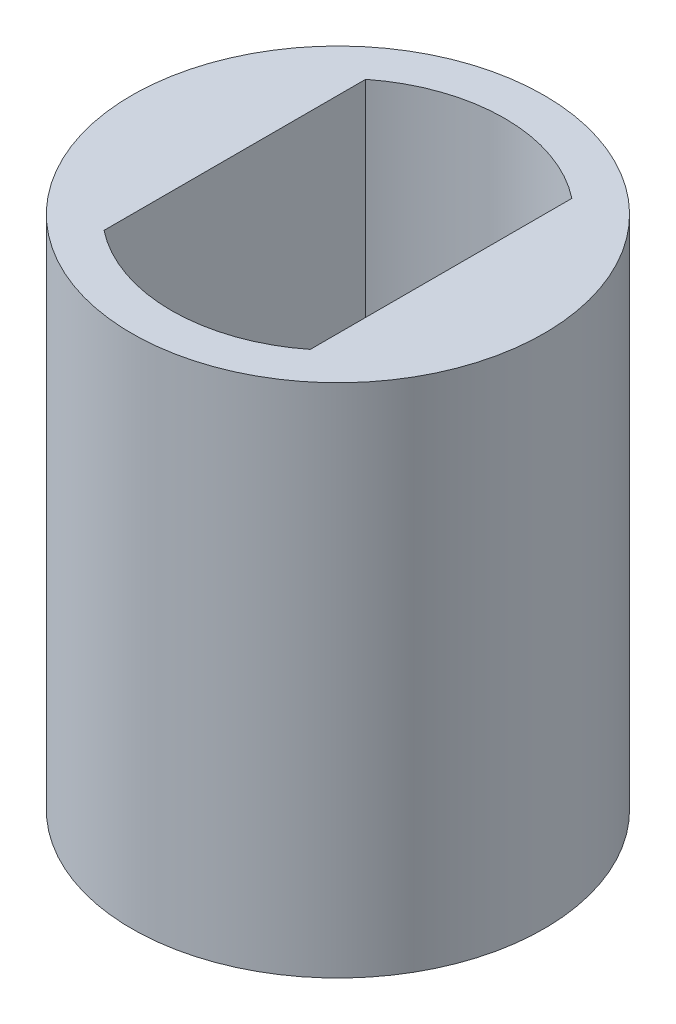
from build123d import *

# Parameters (mm, degrees)
RESSALTO_EXTRUS_O2_DEPTH = 6.5


with BuildPart() as part:
    # Esboço1 → Ressalto-extrusão2 (new body)
    with BuildSketch(Plane(origin=(0, 0, 0), x_dir=(1, 0, 0), z_dir=(0, 1, 0))):
        with BuildLine():
            Line((-1.3, -1.64924225), (-1.3, 1.64924225))
            ThreePointArc((-1.3, 1.64924225), (-2.1, 0), (-1.3, -1.64924225))
        make_face()
        with BuildLine():
            Line((-1.3, 1.64924225), (-1.3, 2.25166605))
            ThreePointArc((-1.3, 2.25166605), (-2.6, 0), (-1.3, -2.25166605))
            Line((-1.3, -2.25166605), (-1.3, -1.64924225))
            ThreePointArc((-1.3, -1.64924225), (-2.1, 0), (-1.3, 1.64924225))
        make_face()
        with BuildLine():
            Line((0, 2.1), (0, 2.6))
            ThreePointArc((0, 2.6), (-0.672929517, 2.511407148), (-1.3, 2.25166605))
            Line((-1.3, 2.25166605), (-1.3, 1.64924225))
            ThreePointArc((-1.3, 1.64924225), (-0.687964852, 1.984112991), (0, 2.1))
        make_face()
        with BuildLine():
            Line((0, -2.6), (0, -2.1))
            ThreePointArc((0, -2.1), (-0.687964852, -1.984112991), (-1.3, -1.64924225))
            Line((-1.3, -1.64924225), (-1.3, -2.25166605))
            ThreePointArc((-1.3, -2.25166605), (-0.672929517, -2.511407148), (0, -2.6))
        make_face()
        with BuildLine():
            ThreePointArc((1.3, 2.25166605), (0.672929517, 2.511407148), (0, 2.6))
            Line((0, 2.6), (0, 2.1))
            ThreePointArc((0, 2.1), (0.687964852, 1.984112991), (1.3, 1.64924225))
            Line((1.3, 1.64924225), (1.3, 2.25166605))
        make_face()
        with BuildLine():
            ThreePointArc((1.3, -1.64924225), (0.687964852, -1.984112991), (0, -2.1))
            Line((0, -2.1), (0, -2.6))
            ThreePointArc((0, -2.6), (0.672929517, -2.511407148), (1.3, -2.25166605))
            Line((1.3, -2.25166605), (1.3, -1.64924225))
        make_face()
        with BuildLine():
            ThreePointArc((2.6, 0), (2.25166605, 1.3), (1.3, 2.25166605))
            Line((1.3, 2.25166605), (1.3, 1.64924225))
            ThreePointArc((1.3, 1.64924225), (1.889444363, 0.916515139), (2.1, 0))
            ThreePointArc((2.1, 0), (1.889444363, -0.916515139), (1.3, -1.64924225))
            Line((1.3, -1.64924225), (1.3, -2.25166605))
            ThreePointArc((1.3, -2.25166605), (2.25166605, -1.3), (2.6, 0))
        make_face()
        with BuildLine():
            ThreePointArc((2.1, 0), (1.889444363, 0.916515139), (1.3, 1.64924225))
            Line((1.3, 1.64924225), (1.3, -1.64924225))
            ThreePointArc((1.3, -1.64924225), (1.889444363, -0.916515139), (2.1, 0))
        make_face()
    extrude(amount=RESSALTO_EXTRUS_O2_DEPTH)


solid = part.part
